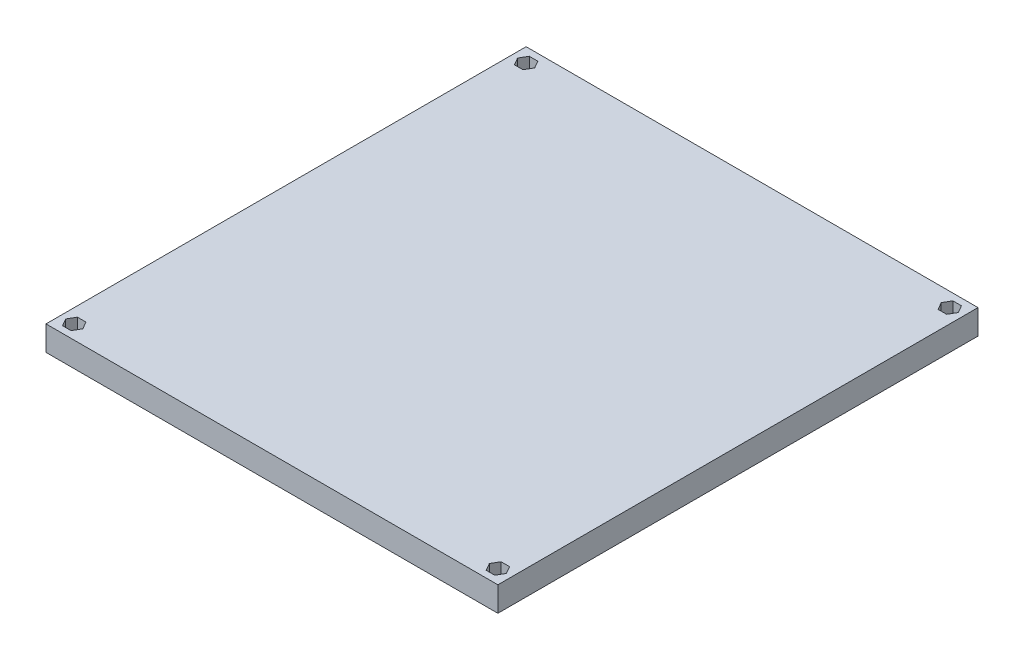
from build123d import *

# Parameters (mm, degrees)
SKETCH1_W           = 64
SKETCH1_H           = 68
BOSS_EXTRUDE1_DEPTH = 3.5
CUT_EXTRUDE1_DEPTH  = 2.3


with BuildPart() as part:
    # Sketch1 → Boss-Extrude1 (new body)
    with BuildSketch(Plane(origin=(0, 0, 0), x_dir=(1, 0, 0), z_dir=(0, 1, 0))):
        with Locations((32, -34)):
            Rectangle(SKETCH1_W, SKETCH1_H)
    extrude(amount=BOSS_EXTRUDE1_DEPTH)

    # Sketch2 → Cut-Extrude1 (cut)
    with BuildSketch(Plane(origin=(0, 3.5, 0), x_dir=(1, 0, 0), z_dir=(0, 1, 0))):
        Polygon((3.212435565, -2), (2.606217783, -0.95), (1.393782217, -0.95), (0.787564435, -2), (1.393782217, -3.05), (2.606217783, -3.05), align=None)
        Polygon((60.787564435, -2), (61.393782217, -3.05), (62.606217783, -3.05), (63.212435565, -2), (62.606217783, -0.95), (61.393782217, -0.95), align=None)
        Polygon((60.787564435, -66), (61.393782217, -67.05), (62.606217783, -67.05), (63.212435565, -66), (62.606217783, -64.95), (61.393782217, -64.95), align=None)
        Polygon((3.212435565, -66), (2.606217783, -64.95), (1.393782217, -64.95), (0.787564435, -66), (1.393782217, -67.05), (2.606217783, -67.05), align=None)
    extrude(amount=-CUT_EXTRUDE1_DEPTH, mode=Mode.SUBTRACT)


solid = part.part
